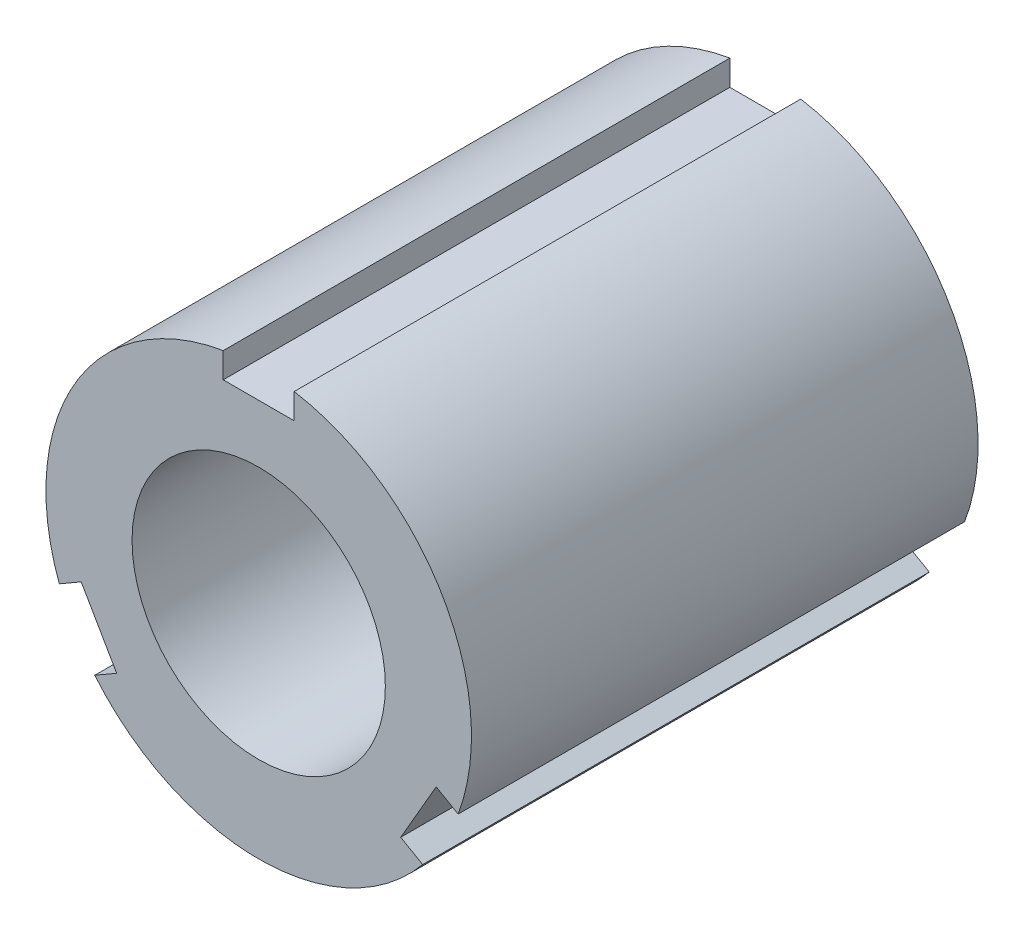
from build123d import *

# Parameters (mm, degrees)
SKETCH_1_R      = 12.5
EXTRUDE_1_DEPTH = 50


with BuildPart() as part:
    # Эскиз1 → Бобышка-Вытянуть1 (new body)
    with BuildSketch(Plane.XY):
        with BuildLine():
            Line((-3.5, 18.206279241), (-3.5, 20.706279241))
            ThreePointArc((-3.5, 20.706279241), (-18.186533479, 10.5), (-19.68216384, -7.322050707))
            Line((-19.68216384, -7.322050707), (-17.517100331, -6.072050707))
            Line((-17.517100331, -6.072050707), (-14.017100331, -12.134228534))
            Line((-14.017100331, -12.134228534), (-16.18216384, -13.384228534))
            ThreePointArc((-16.18216384, -13.384228534), (0, -21), (16.18216384, -13.384228534))
            Line((16.18216384, -13.384228534), (14.017100331, -12.134228534))
            Line((14.017100331, -12.134228534), (17.517100331, -6.072050707))
            Line((17.517100331, -6.072050707), (19.68216384, -7.322050707))
            ThreePointArc((19.68216384, -7.322050707), (20.667915239, -3.719849416), (21, 0))
            ThreePointArc((21, 0), (16.039014932, 13.555441712), (3.5, 20.706279241))
            Line((3.5, 20.706279241), (3.5, 18.206279241))
            Line((3.5, 18.206279241), (-3.5, 18.206279241))
        make_face()
        Circle(SKETCH_1_R, mode=Mode.SUBTRACT)
    extrude(amount=EXTRUDE_1_DEPTH)


solid = part.part
